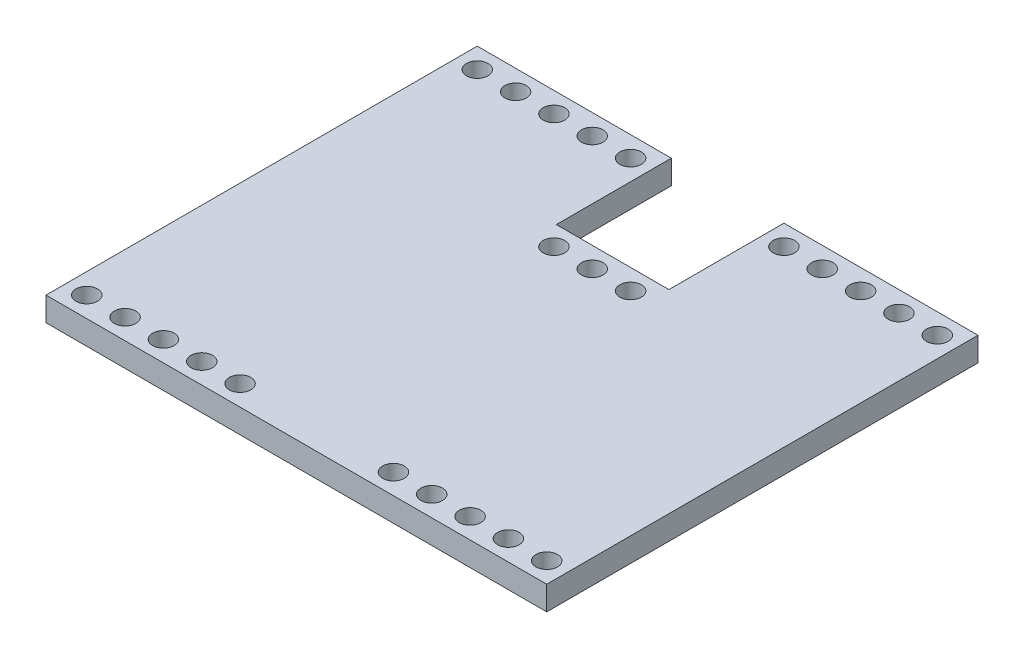
from build123d import *

# Parameters (mm, degrees)
SKETCH_2_R      = 2.25
EXTRUDE_1_DEPTH = 5


with BuildPart() as part:
    # 草图2 → 凸台-拉伸1 (new body)
    with BuildSketch(Plane(origin=(0, 0, 0), x_dir=(1, 0, 0), z_dir=(0, 1, 0))):
        Polygon((-11.75, 45), (-52.25, 45), (-52.25, -45), (52.25, -45), (52.25, 45), (11.75, 45), (11.75, 21), (-11.75, 21), align=None)
        with Locations(Location((-48, -40.75, 0), (0, 0, 270))):
            Circle(SKETCH_2_R, mode=Mode.SUBTRACT)
        with Locations(Location((-40, -40.75, 0), (0, 0, 270))):
            Circle(SKETCH_2_R, mode=Mode.SUBTRACT)
        with Locations(Location((-32, -40.75, 0), (0, 0, 270))):
            Circle(SKETCH_2_R, mode=Mode.SUBTRACT)
        with Locations(Location((-24, -40.75, 0), (0, 0, 270))):
            Circle(SKETCH_2_R, mode=Mode.SUBTRACT)
        with Locations(Location((-16, -40.75, 0), (0, 0, 270))):
            Circle(SKETCH_2_R, mode=Mode.SUBTRACT)
        with Locations(Location((16, -40.75, 0), (0, 0, 270))):
            Circle(SKETCH_2_R, mode=Mode.SUBTRACT)
        with Locations(Location((24, -40.75, 0), (0, 0, 270))):
            Circle(SKETCH_2_R, mode=Mode.SUBTRACT)
        with Locations(Location((32, -40.75, 0), (0, 0, 270))):
            Circle(SKETCH_2_R, mode=Mode.SUBTRACT)
        with Locations(Location((40, -40.75, 0), (0, 0, 270))):
            Circle(SKETCH_2_R, mode=Mode.SUBTRACT)
        with Locations(Location((48, -40.75, 0), (0, 0, 270))):
            Circle(SKETCH_2_R, mode=Mode.SUBTRACT)
        with Locations(Location((-8, 16.75, 0), (0, 0, 270))):
            Circle(SKETCH_2_R, mode=Mode.SUBTRACT)
        with Locations(Location((-48, 40.75, 0), (0, 0, 270))):
            Circle(SKETCH_2_R, mode=Mode.SUBTRACT)
        with Locations(Location((-40, 40.75, 0), (0, 0, 270))):
            Circle(SKETCH_2_R, mode=Mode.SUBTRACT)
        with Locations(Location((-32, 40.75, 0), (0, 0, 270))):
            Circle(SKETCH_2_R, mode=Mode.SUBTRACT)
        with Locations(Location((-24, 40.75, 0), (0, 0, 270))):
            Circle(SKETCH_2_R, mode=Mode.SUBTRACT)
        with Locations(Location((-16, 40.75, 0), (0, 0, 270))):
            Circle(SKETCH_2_R, mode=Mode.SUBTRACT)
        with Locations(Location((0, 16.75, 0), (0, 0, 270))):
            Circle(SKETCH_2_R, mode=Mode.SUBTRACT)
        with Locations(Location((8, 16.75, 0), (0, 0, 270))):
            Circle(SKETCH_2_R, mode=Mode.SUBTRACT)
        with Locations(Location((16, 40.75, 0), (0, 0, 270))):
            Circle(SKETCH_2_R, mode=Mode.SUBTRACT)
        with Locations(Location((24, 40.75, 0), (0, 0, 270))):
            Circle(SKETCH_2_R, mode=Mode.SUBTRACT)
        with Locations(Location((32, 40.75, 0), (0, 0, 270))):
            Circle(SKETCH_2_R, mode=Mode.SUBTRACT)
        with Locations(Location((40, 40.75, 0), (0, 0, 270))):
            Circle(SKETCH_2_R, mode=Mode.SUBTRACT)
        with Locations(Location((48, 40.75, 0), (0, 0, 270))):
            Circle(SKETCH_2_R, mode=Mode.SUBTRACT)
    extrude(amount=EXTRUDE_1_DEPTH)


solid = part.part
